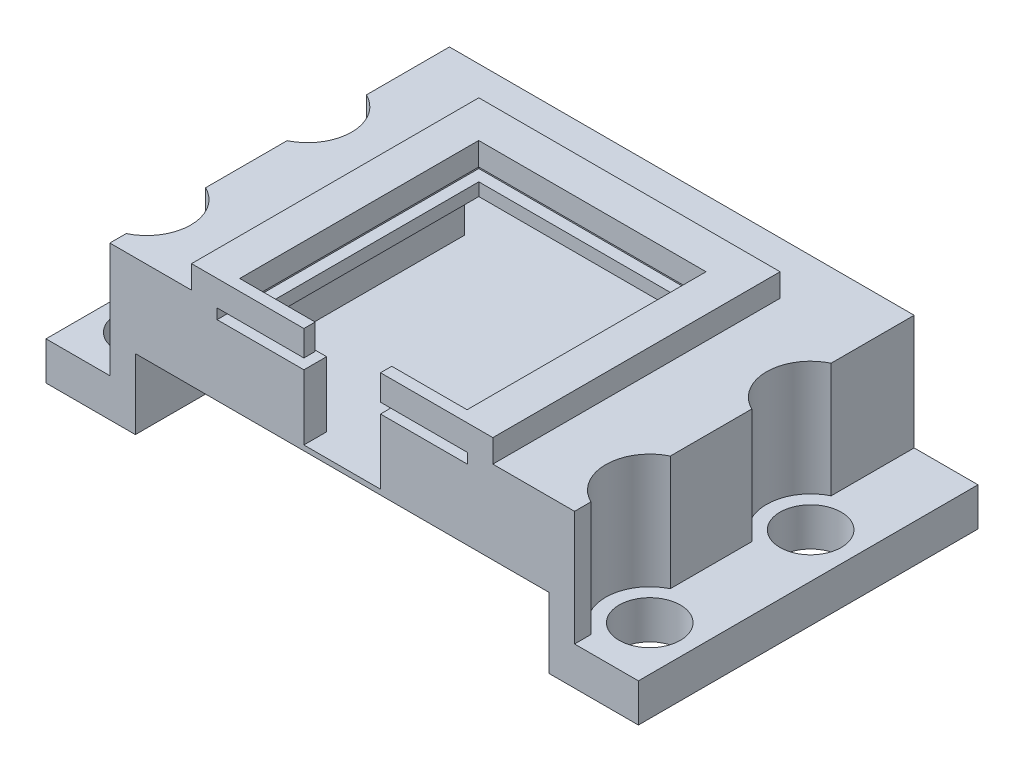
from build123d import *

# Parameters (mm, degrees)
BOSS_EXTRUDE1_DEPTH      = 5.5
SKETCH2_W                = 16.2
SKETCH2_H                = 1.35
CUT_EXTRUDE1_DEPTH       = 3
SKETCH5_W                = 18.2
SKETCH5_H                = 13.3
SKETCH5_W_2              = 9.8
SKETCH5_H_2              = 9.81
BOSS_EXTRUDE2_DEPTH      = 0.5
SKETCH6_W                = 11.107250644
SKETCH6_H                = 10.860006292
SKETCH6_W_2              = 8.9
SKETCH6_H_2              = 8.91
BOSS_EXTRUDE3_DEPTH      = 0.5
SKETCH7_W                = 16.2
SKETCH7_H                = 0.2
BOSS_EXTRUDE4_DEPTH      = 12.3
BOSS_EXTRUDE5_DEPTH      = 1.5
CUT_EXTRUDE7_DEPTH       = 19.035718964
CUT_EXTRUDE7_DEPTH_BACK  = 19.035718964
SKETCH10_R               = 1.2
SKETCH11_R               = 1.725
CUT_EXTRUDE11_DEPTH      = 10
CUT_EXTRUDE12_REACH      = 22.617
SKETCH17_W               = 9.8
SKETCH17_H               = 0.4
BOSS_EXTRUDE7_DEPTH      = 1.5
SKETCH19_W               = 8.904244722
SKETCH19_H               = 0.44
BOSS_EXTRUDE8_DEPTH      = 0.9
CUT_EXTRUDE13_DEPTH      = 1.5
CUT_EXTRUDE13_DEPTH_BACK = 1.5
SKETCH21_W               = 0.89
SKETCH21_H               = 1.9
BOSS_EXTRUDE9_START      = -10.25
SKETCH22_W               = 2.631722889
SKETCH22_H               = 2.55
SKETCH22_W_2             = 2.486658277
BOSS_EXTRUDE9_DEPTH      = 10.25
SKETCH23_W               = 3.968277111
SKETCH23_H               = 0.89
SKETCH23_W_2             = 4.113341723
BOSS_EXTRUDE11_DEPTH     = 2.05
CUT_EXTRUDE14_DEPTH      = 0.6


with BuildPart() as part:
    # Sketch1 → Boss-Extrude1 (new body)
    with BuildSketch(Plane(origin=(0, 0, 0), x_dir=(1, 0, 0), z_dir=(0, 1, 0))):
        Polygon((-11.065671851, -8.782275449), (-12.065671851, -8.782275449), (-12.065671851, 4.517724551), (6.134328149, 4.517724551), (6.134328149, -8.782275449), (5.134328149, -8.782275449), (5.134328149, 3.517724551), (-11.065671851, 3.517724551), align=None)
    extrude(amount=BOSS_EXTRUDE1_DEPTH)

    # Sketch2 → Cut-Extrude1 (cut)
    with BuildSketch(Plane(origin=(0, 0, -4.517724551), x_dir=(-1, 0, 0), z_dir=(0, 0, -1))):
        with Locations((2.965671851, 1.375)):
            Rectangle(SKETCH2_W, SKETCH2_H)
    extrude(amount=-CUT_EXTRUDE1_DEPTH, mode=Mode.SUBTRACT)

    # Sketch5 → Boss-Extrude2 (add)
    with BuildSketch(Plane(origin=(0, 5.5, 0), x_dir=(1, 0, 0), z_dir=(0, 1, 0))):
        with Locations((-2.965671851, -2.132275449)):
            Rectangle(SKETCH5_W, SKETCH5_H)
        with Locations((-2.965671851, -3.437275449)):
            Rectangle(SKETCH5_W_2, SKETCH5_H_2, mode=Mode.SUBTRACT)
    extrude(amount=BOSS_EXTRUDE2_DEPTH)

    # Sketch6 → Boss-Extrude3 (add)
    with BuildSketch(Plane.XZ.offset(-5.5)):
        with Locations((-2.90595545, 3.352272303)):
            Rectangle(SKETCH6_W, SKETCH6_H)
        with Locations((-2.965671851, 3.437275449)):
            Rectangle(SKETCH6_W_2, SKETCH6_H_2, mode=Mode.SUBTRACT)
    extrude(amount=BOSS_EXTRUDE3_DEPTH)

    # Sketch7 → Boss-Extrude4 (add)
    with BuildSketch(Plane.XY.offset(-3.517724551)):
        with Locations((-2.965671851, 2.85)):
            Rectangle(SKETCH7_W, SKETCH7_H)
    extrude(amount=BOSS_EXTRUDE4_DEPTH)

    # Sketch8 → Boss-Extrude5 (add)
    with BuildSketch(Plane(origin=(0, 0, 0), x_dir=(-1, 0, 0), z_dir=(0, -1, 0))):
        Polygon((11.065671851, -8.782275449), (11.065671851, 3.517724551), (11.065671851, 4.517724551), (12.065671851, 4.517724551), (14.565671851, 4.517724551), (14.565671851, -8.782275449), (12.065671851, -8.782275449), align=None)
        Polygon((-5.134328149, -8.782275449), (-5.134328149, 3.517724551), (-5.134328149, 4.517724551), (-6.134328149, 4.517724551), (-8.634328149, 4.517724551), (-8.634328149, -8.782275449), (-6.134328149, -8.782275449), align=None)
    extrude(amount=-BOSS_EXTRUDE5_DEPTH)

    # Sketch10 → Cut-Extrude7 (cut, two sides: drawn at the far end of the back side and taken through both)
    with BuildSketch(Plane(origin=(0, 0, 0), x_dir=(-1, 0, 0), z_dir=(0, -1, 0)).offset(-CUT_EXTRUDE7_DEPTH_BACK)):
        with Locations(Location((12.815671851, -6.587275449, 0), (0, 0, 90))):
            Circle(SKETCH10_R)
        with Locations(Location((12.815671851, -0.287275449, 0), (0, 0, 90))):
            Circle(SKETCH10_R)
        with Locations(Location((-6.884328149, -0.287275449, 0), (0, 0, 90))):
            Circle(SKETCH10_R)
        with Locations(Location((-6.884328149, -6.587275449, 0), (0, 0, 90))):
            Circle(SKETCH10_R)
    extrude(amount=CUT_EXTRUDE7_DEPTH + CUT_EXTRUDE7_DEPTH_BACK, mode=Mode.SUBTRACT)

    # Sketch11 → Cut-Extrude11 (cut)
    with BuildSketch(Plane(origin=(0, 1.5, 0), x_dir=(1, 0, 0), z_dir=(0, 1, 0))):
        with Locations((6.884328149, -0.287275449)):
            Circle(SKETCH11_R)
        with Locations((6.884328149, -6.587275449)):
            Circle(SKETCH11_R)
        with Locations((-12.815671851, -0.287275449)):
            Circle(SKETCH11_R)
        with Locations((-12.815671851, -6.587275449)):
            Circle(SKETCH11_R)
    extrude(amount=CUT_EXTRUDE11_DEPTH, mode=Mode.SUBTRACT)

    # Sketch17 → Cut-Extrude12 (cut, up to next)
    with BuildSketch(Plane.XY.offset(8.782275449), mode=Mode.PRIVATE) as cut_extrude12_sk1:
        with Locations((-2.965671851, 5.7)):
            Rectangle(SKETCH17_W, SKETCH17_H)
    cut_extrude12_tool1 = extrude(cut_extrude12_sk1.sketch, amount=-CUT_EXTRUDE12_REACH, mode=Mode.PRIVATE) & part.part
    add(cut_extrude12_tool1.solids().sort_by_distance((-2.965672, 5.7, 8.782275))[0], mode=Mode.SUBTRACT)

    # Sketch18 → Boss-Extrude7 (add)
    with BuildSketch(Plane(origin=(0, 6, 0), x_dir=(1, 0, 0), z_dir=(0, 1, 0))):
        Polygon((-7.419916573, -8.782275449), (-8.865671851, -8.782275449), (-8.865671851, 2.467724551), (-7.419916573, 2.467724551), (1.484328149, 2.467724551), (2.934328149, 2.467724551), (2.934328149, -8.782275449), (1.484328149, -8.782275449), (1.484328149, 1.017724551), (-7.419916573, 1.017724551), align=None)
    extrude(amount=BOSS_EXTRUDE7_DEPTH)

    # Sketch19 → Boss-Extrude8 (add)
    with BuildSketch(Plane(origin=(0, 6, 0), x_dir=(1, 0, 0), z_dir=(0, 1, 0))):
        with Locations((-2.967794212, -8.562275449)):
            Rectangle(SKETCH19_W, SKETCH19_H)
    extrude(amount=BOSS_EXTRUDE8_DEPTH)

    # Sketch21 → Cut-Extrude13 (cut, two sides: drawn at the far end of the back side and taken through both)
    with BuildSketch(Plane(origin=(-2.965671851, 0, 0), x_dir=(0, 0, -1), z_dir=(1, 0, 0)).offset(-CUT_EXTRUDE13_DEPTH_BACK)):
        with Locations((-8.337275449, 5.95)):
            Rectangle(SKETCH21_W, SKETCH21_H)
    extrude(amount=CUT_EXTRUDE13_DEPTH + CUT_EXTRUDE13_DEPTH_BACK, mode=Mode.SUBTRACT)

    # Sketch22 → Boss-Extrude9 (add)
    with BuildSketch(Plane.XY.offset(8.782275449).offset(BOSS_EXTRUDE9_START)):
        with Locations((-9.749810406, 4.225)):
            Rectangle(SKETCH22_W, SKETCH22_H)
        with Locations((3.89099901, 4.225)):
            Rectangle(SKETCH22_W_2, SKETCH22_H)
    extrude(amount=BOSS_EXTRUDE9_DEPTH)

    # Sketch23 → Boss-Extrude11 (add)
    with BuildSketch(Plane(origin=(0, 5, 0), x_dir=(1, 0, 0), z_dir=(0, 1, 0))):
        with Locations((-6.449810407, -8.337275449)):
            Rectangle(SKETCH23_W, SKETCH23_H)
        with Locations((0.590999011, -8.337275449)):
            Rectangle(SKETCH23_W_2, SKETCH23_H)
    extrude(amount=-BOSS_EXTRUDE11_DEPTH)

    # Sketch24 → Cut-Extrude14 (cut)
    with BuildSketch(Plane(origin=(0, 7.5, 0), x_dir=(1, 0, 0), z_dir=(0, 1, 0))):
        Polygon((-8.865671851, 1.017724551), (-8.865671851, -8.782275449), (-7.419916573, -8.782275449), (-7.419916573, 1.017724551), (1.484328149, 1.017724551), (1.484328149, -8.782275449), (2.934328149, -8.782275449), (2.934328149, 1.017724551), (2.934328149, 2.467724551), (1.484328149, 2.467724551), (-7.500141942, 2.467724551), (-8.865671851, 2.467724551), align=None)
    extrude(amount=-CUT_EXTRUDE14_DEPTH, mode=Mode.SUBTRACT)


solid = part.part
